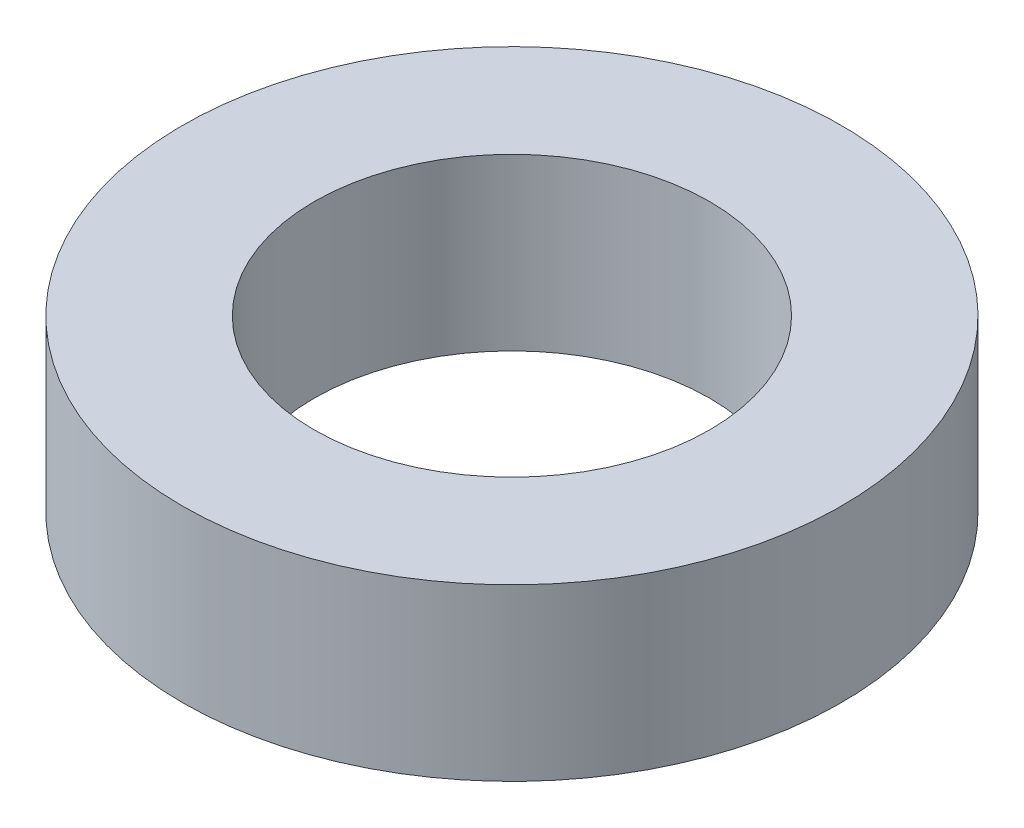
from build123d import *

# Parameters (mm, degrees)
SKETCH1_R           = 15
SKETCH1_R_2         = 9
BOSS_EXTRUDE1_DEPTH = 7.75


with BuildPart() as part:
    # Sketch1 → Boss-Extrude1 (new body)
    with BuildSketch(Plane(origin=(0, 0, 0), x_dir=(1, 0, 0), z_dir=(0, 1, 0))):
        with Locations(Location((0, 0, 0), (0, 0, 270))):
            Circle(SKETCH1_R)
        with Locations(Location((0, 0, 0), (0, 0, 270))):
            Circle(SKETCH1_R_2, mode=Mode.SUBTRACT)
    extrude(amount=BOSS_EXTRUDE1_DEPTH)


solid = part.part
